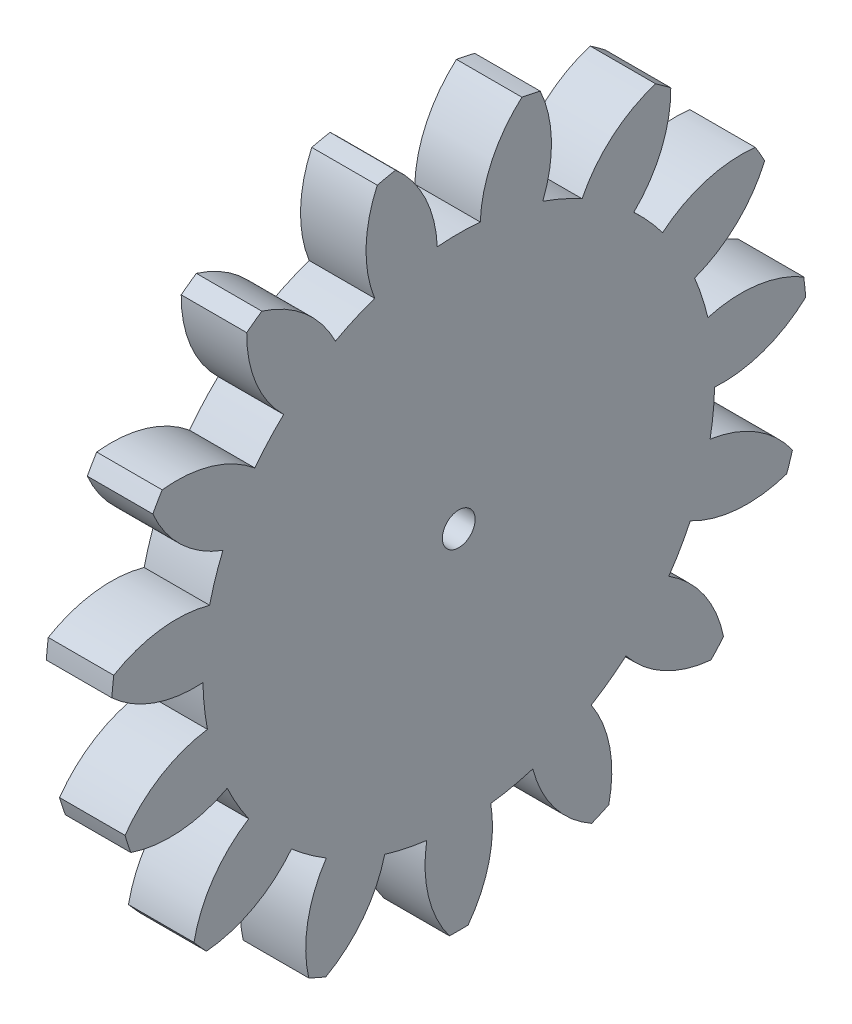
from build123d import *

# Parameters (mm, degrees)
BASPROSKE_W     = 8
BASPROSKE_H     = 42.5
TOOTHCUT_DEPTH  = 61.634148794
TEETHCUTS_COUNT = 15
TEETHCUTS_ANGLE = 336
BORSKE_R        = 2
BORE_DEPTH      = 50.0000508


with BuildPart() as part:
    # BasProSke → Base-Revolve (revolve)
    with BuildSketch(Plane(origin=(0, 0, 0), x_dir=(1, 0, 0), z_dir=(0, 1, 0)), mode=Mode.PRIVATE) as base_revolve_sk:
        with Locations((4, 21.25)):
            Rectangle(BASPROSKE_W, BASPROSKE_H)
    revolve(base_revolve_sk.sketch.rotate(Axis((-10, 0, 0), (1, 0, 0)), 180), axis=Axis((-10, 0, 0), (1, 0, 0)))

    # TooCutSke → ToothCut (cut, through all)
    with BuildSketch(Plane(origin=(0, 0, 0), x_dir=(0, 0, -1), z_dir=(1, 0, 0))):
        with BuildLine():
            ThreePointArc((2.624472836, 31.138595719), (0, 31.249), (-2.624472836, 31.138595719))
            ThreePointArc((-2.624472836, 31.138595719), (-4.084227986, 37.002862003), (-7.739685892, 41.815151649))
            ThreePointArc((-7.739685892, 41.815151649), (0, 42.5254), (7.739685892, 41.815151649))
            ThreePointArc((7.739685892, 41.815151649), (4.084227986, 37.002862003), (2.624472836, 31.138595719))
        make_face()
    toothcut = extrude(amount=TOOTHCUT_DEPTH, mode=Mode.SUBTRACT)

    # TeethCuts: ToothCut ×15 about axis
    teethcuts_axis = Axis((-10, 0, 0), (1, 0, 0))
    for i in range(1, TEETHCUTS_COUNT):
        add(toothcut.rotate(teethcuts_axis, i * TEETHCUTS_ANGLE / (TEETHCUTS_COUNT - 1)), mode=Mode.SUBTRACT)

    # BorSke → Bore (cut, symmetric)
    with BuildSketch(Plane(origin=(0, 0, 0), x_dir=(0, 0, -1), z_dir=(1, 0, 0))):
        with Locations(Location((0, 0, 0), (0, 0, 180))):
            Circle(BORSKE_R)
    extrude(amount=BORE_DEPTH, both=True, mode=Mode.SUBTRACT)


solid = part.part
